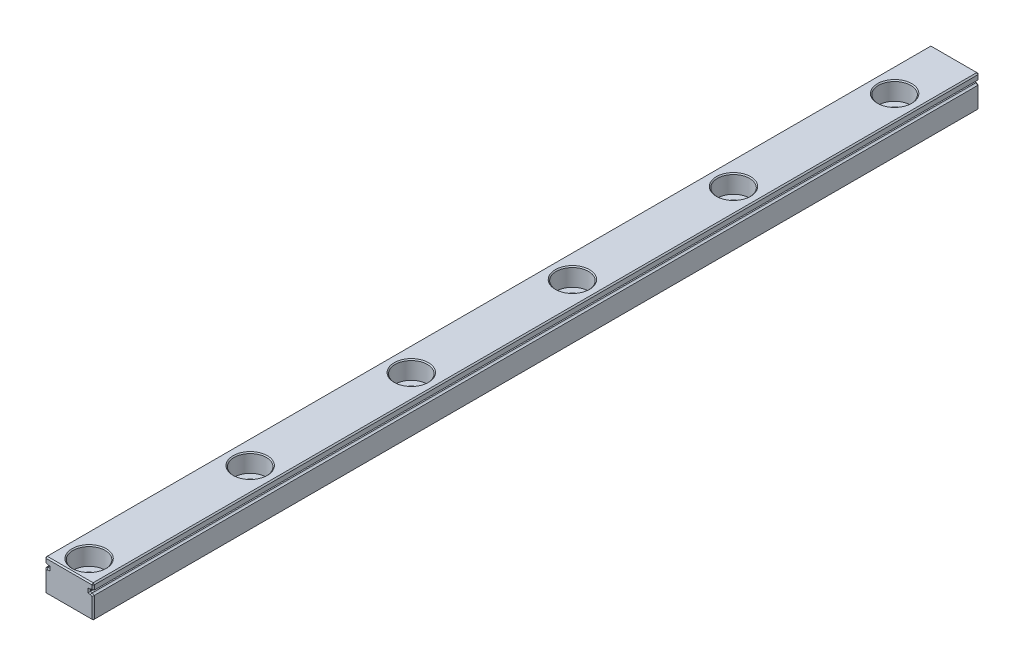
from build123d import *

# Parameters (mm, degrees)
BOSS_EXTRUDE1_DEPTH = 220
CHAMFER1_SIZE       = 0.3
LPATTERN1_COUNT     = 6
LPATTERN1_PITCH     = 40


with BuildPart() as part:
    # Sketch1 → Boss-Extrude1 (new body)
    with BuildSketch(Plane.XY):
        with BuildLine():
            Line((0, 8), (12, 8))
            Line((12, 8), (12, 6.75))
            Line((12, 6.75), (12, 6.559016994))
            ThreePointArc((12, 6.559016994), (11.706107374, 6.475528258), (11.5, 6.25))
            Line((11.5, 6.25), (11, 6.25))
            Line((11, 6.25), (11, 5.75))
            Line((11, 5.75), (11.5, 5.75))
            ThreePointArc((11.5, 5.75), (11.706107374, 5.524471742), (12, 5.440983006))
            Line((12, 5.440983006), (12, 5.25))
            Line((12, 5.25), (12, 0))
            Line((12, 0), (0, 0))
            Line((0, 0), (0, 5.25))
            Line((0, 5.25), (0, 5.440983006))
            ThreePointArc((0, 5.440983006), (0.293892626, 5.524471742), (0.5, 5.75))
            Line((0.5, 5.75), (1, 5.75))
            Line((1, 5.75), (1, 6.25))
            Line((1, 6.25), (0.5, 6.25))
            ThreePointArc((0.5, 6.25), (0.293892626, 6.475528258), (0, 6.559016994))
            Line((0, 6.559016994), (0, 6.75))
            Line((0, 6.75), (0, 8))
        make_face()
    extrude(amount=BOSS_EXTRUDE1_DEPTH)

    # Chamfer1
    chamfer1_edges = [part.edges().sort_by_distance(p)[0] for p in [
        (12, 2.720491503, 220),
        (11.706107374, 5.524471742, 220),
        (0, 2.720491503, 0),
        (0.293892626, 5.524471742, 0),
        (0.75, 5.75, 0),
        (1, 6, 0),
        (0.75, 6.25, 0),
        (11.25, 5.75, 220),
        (0.293892626, 6.475528258, 0),
        (0, 7.279508497, 0),
        (6, 8, 0),
        (12, 7.279508497, 0),
        (11.706107374, 6.475528258, 0),
        (11, 6, 220),
        (11.25, 6.25, 0),
        (11, 6, 0),
        (11.25, 5.75, 0),
        (11.706107374, 5.524471742, 0),
        (12, 2.720491503, 0),
        (6, 0, 0),
        (11.25, 6.25, 220),
        (11.706107374, 6.475528258, 220),
        (12, 7.279508497, 220),
        (0, 8, 110),
        (12, 8, 110),
        (12, 0, 110),
        (0, 0, 110),
        (6, 8, 220),
        (0, 2.720491503, 220),
        (0, 7.279508497, 220),
        (0.293892626, 6.475528258, 220),
        (0.75, 6.25, 220),
        (1, 6, 220),
        (0.75, 5.75, 220),
        (0.293892626, 5.524471742, 220),
        (6, 0, 220),
    ]]
    chamfer(chamfer1_edges, length=CHAMFER1_SIZE)

    # Sketch3 → CBORE for M5 Hex Head Bolt1 (revolve, cut)
    with BuildSketch(Plane(origin=(6, 8, 15), x_dir=(0, 0, 1), z_dir=(1, 0, 0))):
        Polygon((0, 0), (0, 8), (2.5, 8), (2.25, 7.75), (2.25, 4.5), (4, 4.5), (4, 0.25), (4.25, 0), align=None)
    cbore_for_m5_hex_head_bolt1 = revolve(axis=Axis((6, 14.35, 15), (0, -1, 0)), mode=Mode.SUBTRACT)

    # LPattern1: CBORE for M5 Hex Head Bolt1 ×6
    with Locations(*[(0, 0, i * LPATTERN1_PITCH) for i in range(1, LPATTERN1_COUNT)]):
        add(cbore_for_m5_hex_head_bolt1, mode=Mode.SUBTRACT)


solid = part.part
